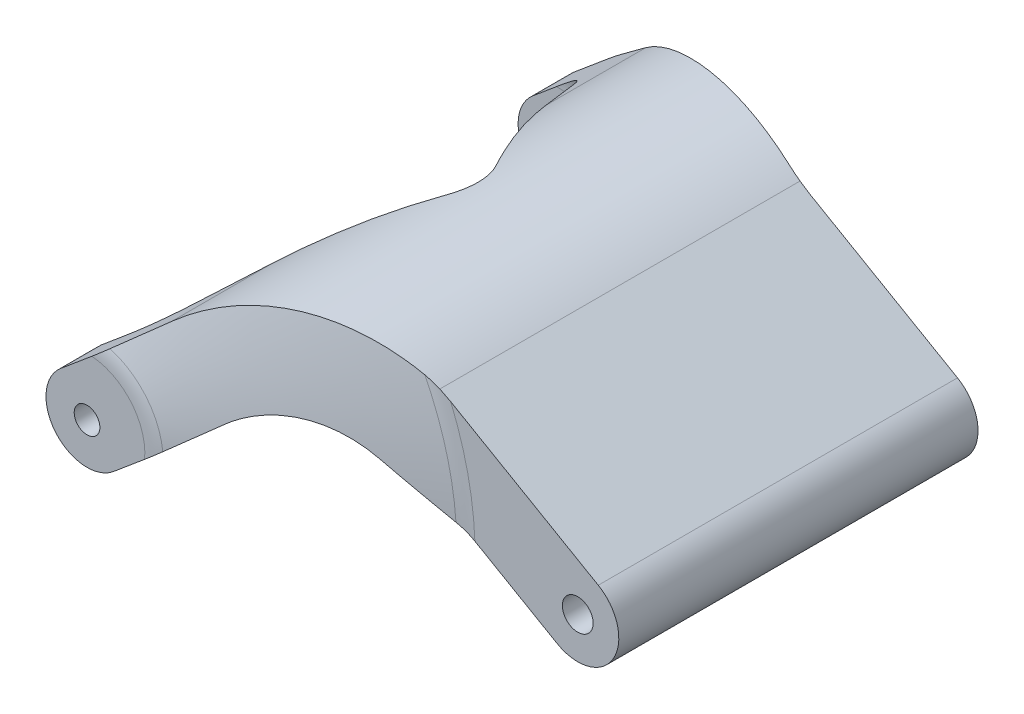
from build123d import *

# Parameters (mm, degrees)
ESQUISSE1_R        = 1.25
ESQUISSE1_R_2      = 1.5
BOSS_EXTRU_1_DEPTH = 25


with BuildPart() as part:
    # Esquisse1 → Boss.-Extru.1 (new, symmetric)
    with BuildSketch(Plane.XY):
        with BuildLine():
            Line((-2.571150439, 3.064177772), (6.350420085, 10.550264309))
            ThreePointArc((6.350420085, 10.550264309), (16.35179369, 14.692968898), (26.92059706, 12.349921601))
            Line((26.92059706, 12.349921601), (42.311288741, 3.464101615))
            ThreePointArc((42.311288741, 3.464101615), (43.775390357, -2), (38.311288741, -3.464101615))
            Line((38.311288741, -3.464101615), (22.92059706, 5.42171837))
            ThreePointArc((22.92059706, 5.42171837), (17.049039632, 6.723411313), (11.492720963, 4.421908764))
            Line((11.492720963, 4.421908764), (2.571150439, -3.064177772))
            ThreePointArc((2.571150439, -3.064177772), (-3.064177772, -2.571150439), (-2.571150439, 3.064177772))
        make_face()
        Circle(ESQUISSE1_R, mode=Mode.SUBTRACT)
        with Locations((40.311288741, 0)):
            Circle(ESQUISSE1_R_2, mode=Mode.SUBTRACT)
    extrude(amount=BOSS_EXTRU_1_DEPTH, both=True)

    # Esquisse4 → Enlèvement de matière-Révolution1 (revolve, cut)
    with BuildSketch(Plane(origin=(0, 0, 0), x_dir=(1, 0, 0), z_dir=(0, 1, 0))):
        with BuildLine():
            Line((80, 17.5), (80, 25))
            Line((80, 25), (5.633213888, 25))
            ThreePointArc((5.633213888, 25), (6.414996134, 24.93850347), (7.177547622, 24.755526608))
            Line((7.177547622, 24.755526608), (28.766955008, 17.744473392))
            ThreePointArc((28.766955008, 17.744473392), (29.529506495, 17.56149653), (30.311288741, 17.5))
            Line((30.311288741, 17.5), (80, 17.5))
        make_face()
        with BuildLine():
            Line((0, 21), (5, 21))
            ThreePointArc((5, 21), (7.5, 20.330127019), (9.330127019, 18.5))
            Line((9.330127019, 18.5), (18.567731326, 2.5))
            ThreePointArc((18.567731326, 2.5), (19.237604307, 0), (18.567731326, -2.5))
            Line((18.567731326, -2.5), (9.330127019, -18.5))
            ThreePointArc((9.330127019, -18.5), (7.5, -20.330127019), (5, -21))
            Line((5, -21), (0, -21))
            Line((0, -21), (0, 21))
        make_face()
        with BuildLine():
            Line((30.311288741, -17.5), (80, -17.5))
            Line((80, -17.5), (80, -25))
            Line((80, -25), (5.633213888, -25))
            ThreePointArc((5.633213888, -25), (6.414996134, -24.93850347), (7.177547622, -24.755526608))
            Line((7.177547622, -24.755526608), (28.766955008, -17.744473392))
            ThreePointArc((28.766955008, -17.744473392), (29.529506495, -17.56149653), (30.311288741, -17.5))
        make_face()
    revolve(axis=Axis((0, 0, 25), (0, 0, -1)), mode=Mode.SUBTRACT)


solid = part.part
